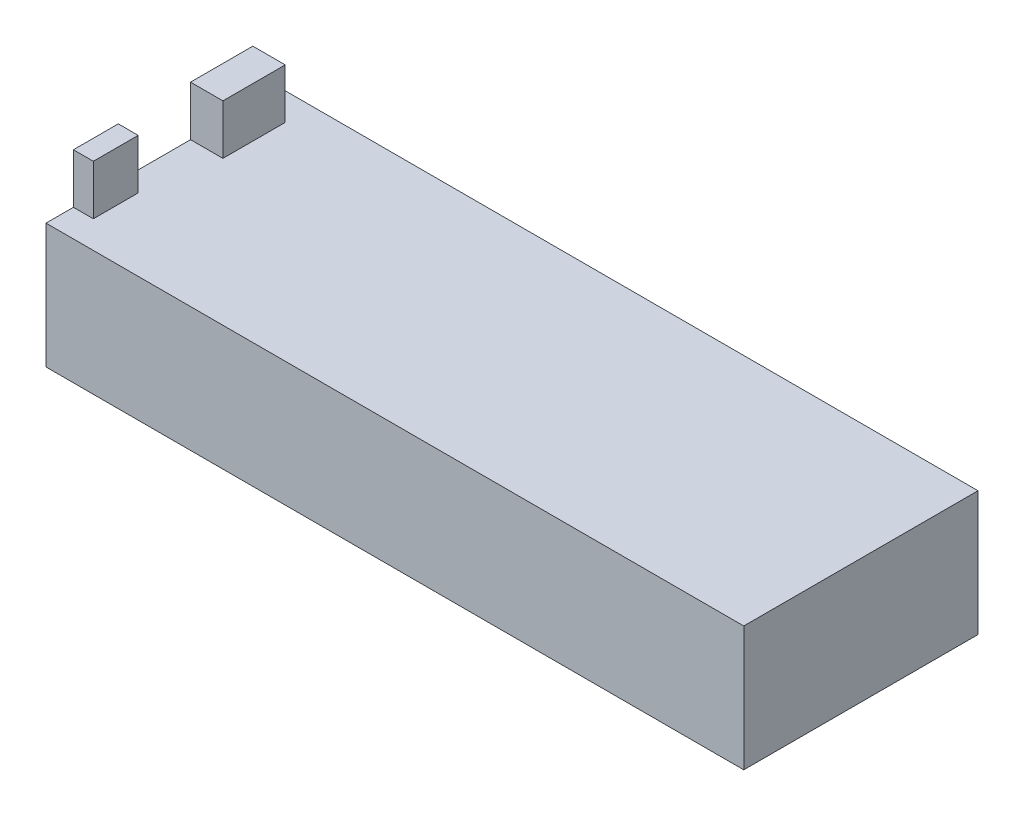
from build123d import *

# Parameters (mm, degrees)
SKETCH1_W           = 140
SKETCH1_H           = 47
BOSS_EXTRUDE1_DEPTH = 25
SKETCH2_W           = 6.5
SKETCH2_H           = 12.5
SKETCH2_W_2         = 4
SKETCH2_H_2         = 9
BOSS_EXTRUDE2_DEPTH = 10


with BuildPart() as part:
    # Sketch1 → Boss-Extrude1 (new body)
    with BuildSketch(Plane(origin=(0, 0, 0), x_dir=(1, 0, 0), z_dir=(0, 1, 0))):
        Rectangle(SKETCH1_W, SKETCH1_H)
    extrude(amount=BOSS_EXTRUDE1_DEPTH)

    # Sketch2 → Boss-Extrude2 (add)
    with BuildSketch(Plane(origin=(0, 25, 0), x_dir=(1, 0, 0), z_dir=(0, 1, 0))):
        with Locations((-66.75, 11.75)):
            Rectangle(SKETCH2_W, SKETCH2_H)
        with Locations((-68, -13.5)):
            Rectangle(SKETCH2_W_2, SKETCH2_H_2)
    extrude(amount=BOSS_EXTRUDE2_DEPTH)


solid = part.part
